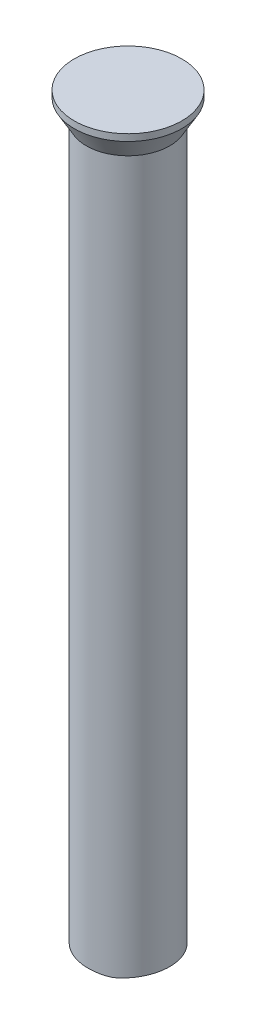
from build123d import *

# Parameters (mm, degrees)
CUT_EXTRUDE1_DEPTH = 56.489098028
CIRPATTERN1_COUNT  = 3


with BuildPart() as part:
    # Sketch1 → Revolve1 (revolve)
    with BuildSketch(Plane.XY, mode=Mode.PRIVATE) as revolve1_sk:
        Polygon((0, 0), (4, 0), (4, -0.5), (3.1, -2.058845727), (3.1, -55.2), (0, -55.2), align=None)
    revolve(revolve1_sk.sketch.rotate(Axis((0, -60.2, 0), (0, 1, 0)), 90), axis=Axis((0, -60.2, 0), (0, 1, 0)))

    # Sketch2 → Cut-Extrude1 (cut, symmetric)
    with BuildSketch(Plane.XY):
        Polygon((0, -55.2), (3.1, -55.2), (3.1, -54.928785143), align=None)
    cut_extrude1 = extrude(amount=CUT_EXTRUDE1_DEPTH, both=True, mode=Mode.SUBTRACT)

    # CirPattern1: Cut-Extrude1 ×3 about axis
    cirpattern1_axis = Axis((0, 0, 0), (0, 1, 0))
    for i in range(1, CIRPATTERN1_COUNT):
        add(cut_extrude1.rotate(cirpattern1_axis, i * 360 / CIRPATTERN1_COUNT), mode=Mode.SUBTRACT)


solid = part.part
